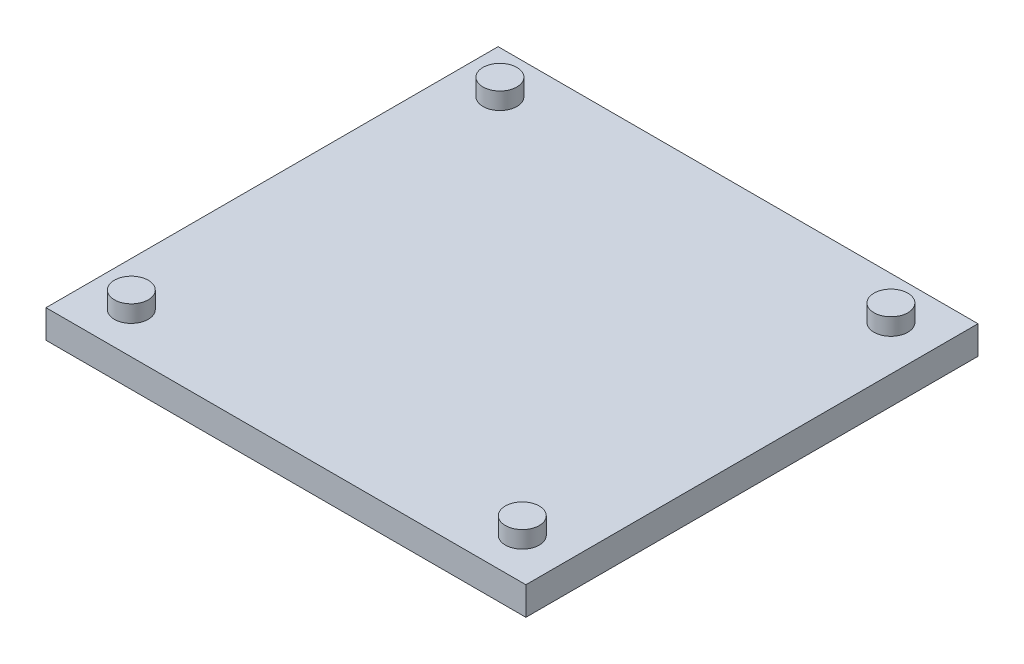
from build123d import *

# Parameters (mm, degrees)
SKETCH_4_W           = 84.916455131
SKETCH_4_H           = 80
SKETCH_4_R           = 3
EXTRUDE_1_DEPTH      = 5
EXTRUDE_2_DEPTH      = 3
EXTRUDE_2_DEPTH_BACK = 5
SKETCH_5_R           = 3


with BuildPart() as part:
    # 草图4 → 凸台-拉伸1 (new body)
    with BuildSketch(Plane(origin=(0, 0, 0), x_dir=(1, 0, 0), z_dir=(0, 1, 0))):
        with Locations((-1.967483917, -58.11712094)):
            Rectangle(SKETCH_4_W, SKETCH_4_H)
        with Locations(Location((-36.585071707, -25.636349073, 0), (0, 0, 270))):
            Circle(SKETCH_4_R, mode=Mode.SUBTRACT)
        with Locations(Location((32.601613083, -25.636349073, 0), (0, 0, 270))):
            Circle(SKETCH_4_R, mode=Mode.SUBTRACT)
        with Locations(Location((-36.585071707, -90.861964123, 0), (0, 0, 270))):
            Circle(SKETCH_4_R, mode=Mode.SUBTRACT)
        with Locations(Location((32.601613083, -90.861964123, 0), (0, 0, 270))):
            Circle(SKETCH_4_R, mode=Mode.SUBTRACT)
    extrude(amount=EXTRUDE_1_DEPTH)

    # 草图5 → 凸台-拉伸2 (add, two sides: drawn at the far end of the back side and taken through both)
    with BuildSketch(Plane(origin=(0, 5, 0), x_dir=(1, 0, 0), z_dir=(0, 1, 0)).offset(-EXTRUDE_2_DEPTH_BACK)):
        with Locations(Location((-36.585071707, -25.636349073, 0), (0, 0, 270))):
            Circle(SKETCH_5_R)
        with Locations(Location((32.601613083, -25.636349073, 0), (0, 0, 270))):
            Circle(SKETCH_5_R)
        with Locations(Location((-36.585071707, -90.861964123, 0), (0, 0, 270))):
            Circle(SKETCH_5_R)
        with Locations(Location((32.601613083, -90.861964123, 0), (0, 0, 270))):
            Circle(SKETCH_5_R)
    extrude(amount=EXTRUDE_2_DEPTH + EXTRUDE_2_DEPTH_BACK)


solid = part.part
